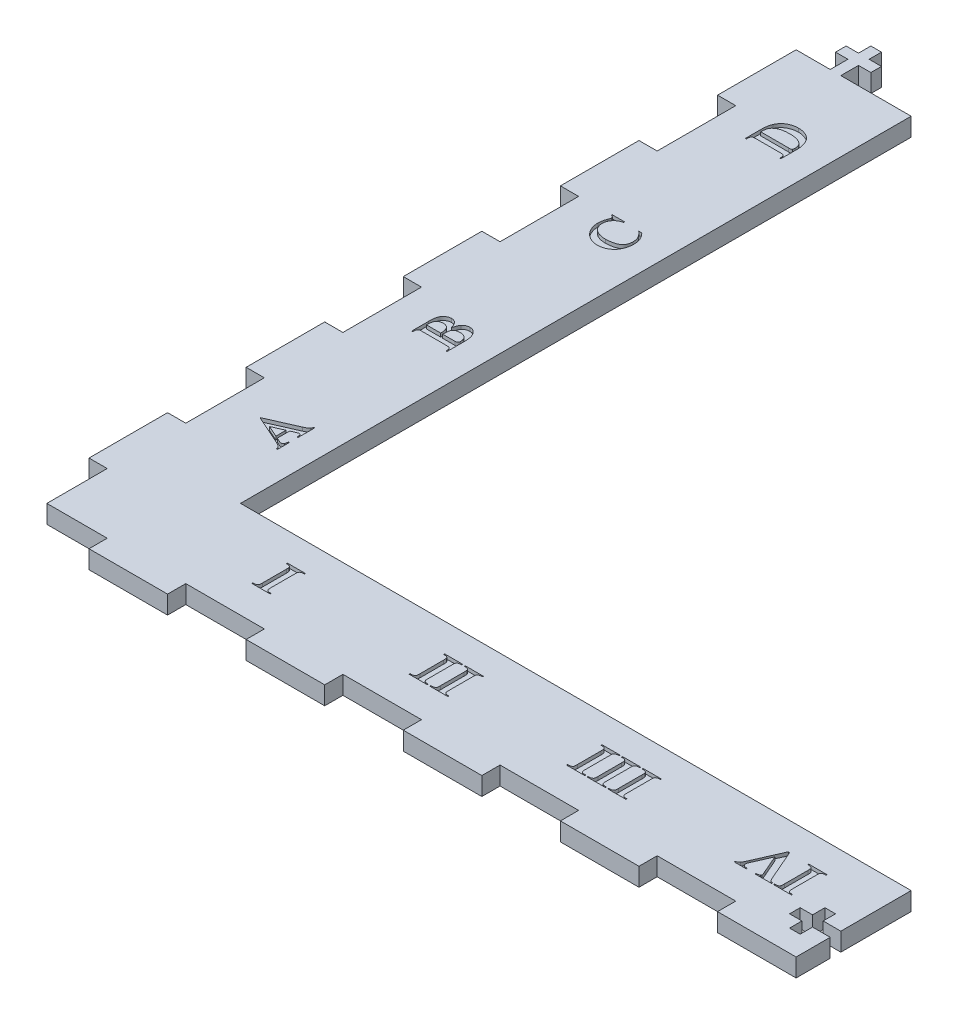
from build123d import *

# Parameters (mm, degrees)
SKETCH1_W           = 222.25
SKETCH1_H           = 222.25
BOSS_EXTRUDE1_DEPTH = 5.15
SKETCH2_W           = 17.075
SKETCH2_H           = 5.15
SKETCH2_W_2         = 22.225
SKETCH2_W_3         = 5.15
SKETCH2_H_2         = 22.225
CUT_EXTRUDE1_DEPTH  = 315.351153171
SKETCH3_W           = 189.70625
SKETCH3_H           = 189.70625
CUT_EXTRUDE2_DEPTH  = 315.351153171
BOSS_EXTRUDE2_DEPTH = 5.15
CUT_EXTRUDE3_DEPTH  = 323.584326185
CUT_EXTRUDE4_DEPTH  = 1


with BuildPart() as part:
    # Sketch1 → Boss-Extrude1 (new body)
    with BuildSketch(Plane(origin=(0, 0, 0), x_dir=(1, 0, 0), z_dir=(0, 1, 0))):
        with Locations((111.125, 111.125)):
            Rectangle(SKETCH1_W, SKETCH1_H)
    extrude(amount=BOSS_EXTRUDE1_DEPTH)

    # Sketch2 → Cut-Extrude1 (cut, through all)
    with BuildSketch(Plane(origin=(0, 5.15, 0), x_dir=(1, 0, 0), z_dir=(0, 1, 0))):
        with Locations((13.6875, 2.575)):
            Rectangle(SKETCH2_W, SKETCH2_H)
        Polygon((0, 22.225), (0, 0), (5.15, 0), (5.15, 5.15), (5.15, 22.225), align=None)
        with Locations((55.5625, 2.575)):
            Rectangle(SKETCH2_W_2, SKETCH2_H)
        with Locations((100.0125, 2.575)):
            Rectangle(SKETCH2_W_2, SKETCH2_H)
        with Locations((144.4625, 2.575)):
            Rectangle(SKETCH2_W_2, SKETCH2_H)
        with Locations((188.9125, 2.575)):
            Rectangle(SKETCH2_W_2, SKETCH2_H)
        with Locations((2.575, 55.5625)):
            Rectangle(SKETCH2_W_3, SKETCH2_H_2)
        with Locations((2.575, 144.4625)):
            Rectangle(SKETCH2_W_3, SKETCH2_H_2)
        with Locations((2.575, 100.0125)):
            Rectangle(SKETCH2_W_3, SKETCH2_H_2)
        with Locations((2.575, 188.9125)):
            Rectangle(SKETCH2_W_3, SKETCH2_H_2)
    extrude(amount=-CUT_EXTRUDE1_DEPTH, mode=Mode.SUBTRACT)

    # Sketch3 → Cut-Extrude2 (cut, through all)
    with BuildSketch(Plane(origin=(0, 5.15, 0), x_dir=(1, 0, 0), z_dir=(0, 1, 0))):
        with Locations((127.396875, 127.396875)):
            Rectangle(SKETCH3_W, SKETCH3_H)
    extrude(amount=-CUT_EXTRUDE2_DEPTH, mode=Mode.SUBTRACT)

    # Sketch4 → Boss-Extrude2 (add)
    with BuildSketch(Plane(origin=(0, 5.15, 0), x_dir=(1, 0, 0), z_dir=(0, 1, 0))):
        Polygon((9.65, 222.25), (9.65, 227.25), (6.15, 227.25), (6.15, 230.25), (9.65, 230.25), (9.65, 233.75), (12.65, 233.75), (12.65, 230.25), (16.15, 230.25), (16.15, 227.25), (12.65, 227.25), (12.65, 222.25), align=None)
    extrude(amount=-BOSS_EXTRUDE2_DEPTH)

    # Sketch5 → Cut-Extrude3 (cut, through all)
    with BuildSketch(Plane(origin=(0, 5.15, 0), x_dir=(1, 0, 0), z_dir=(0, 1, 0))):
        Polygon((222.25, 9.65), (217.25, 9.65), (217.25, 6.15), (214.25, 6.15), (214.25, 9.65), (210.75, 9.65), (210.75, 12.65), (214.25, 12.65), (214.25, 16.15), (217.25, 16.15), (217.25, 12.65), (222.25, 12.65), align=None)
    extrude(amount=-CUT_EXTRUDE3_DEPTH, mode=Mode.SUBTRACT)

    # Sketch6 → Cut-Extrude4 (cut)
    # profile 1 of 12: a face of its own
    with BuildSketch(Plane(origin=(0, 5.15, 0), x_dir=(1, 0, 0), z_dir=(0, 1, 0))):
        with BuildLine():
            Line((21.765972222, 57.207552083), (21.765972222, 53.713628472))
            Line((21.765972222, 53.713628472), (22.764236111, 53.270920139))
            add(Edge.make_bspline(
                [(22.764236111, 53.270920139), (22.836755056, 53.239084656), (22.972593893, 53.179452032), (23.172814371, 53.116743409), (23.351980656, 53.073827045), (23.466441293, 53.067627678), (23.519444444, 53.064756944)],
                knots=[0, 0, 0, 0, 1.20511019, 2.257351726, 3.193033938, 4, 4, 4, 4], degree=3))
            add(Edge.make_bspline(
                [(23.519444444, 53.064756944), (23.581604326, 53.068497188), (23.70013899, 53.075629577), (23.864645043, 53.14256425), (24.002741256, 53.252414712), (24.066101927, 53.351864186), (24.098871528, 53.403298611)],
                knots=[0, 0, 0, 0, 1.052508737, 2.007062559, 2.969269661, 4, 4, 4, 4], degree=3))
            add(Edge.make_bspline(
                [(24.098871528, 53.403298611), (24.107881703, 53.422692947), (24.128174964, 53.46637404), (24.153864012, 53.543329141), (24.176857773, 53.638524148), (24.198251142, 53.751552211), (24.217808784, 53.882580057), (24.234031145, 54.031849356), (24.252252193, 54.198811669), (24.261253683, 54.316171495), (24.265972222, 54.377690972)],
                knots=[0, 0, 0, 0, 0.516447785, 1.163174827, 1.955925178, 2.881493115, 3.941972439, 5.15611017, 6.509246131, 8, 8, 8, 8], degree=3))
            Line((24.265972222, 54.377690972), (24.54375, 54.377690972))
            Line((24.54375, 54.377690972), (24.54375, 50.972743056))
            Line((24.54375, 50.972743056), (24.265972222, 50.972743056))
            add(Edge.make_bspline(
                [(24.265972222, 50.972743056), (24.250147403, 51.058927082), (24.219390032, 51.226435725), (24.124132192, 51.459779652), (24.001559136, 51.672360093), (23.862386161, 51.826449701), (23.730250839, 51.94468162), (23.604884367, 52.037155641), (23.457645405, 52.13705546), (23.285650779, 52.240737551), (23.090526778, 52.348502637), (22.871892222, 52.461900821), (22.630211745, 52.580540545), (22.459861037, 52.659295874), (22.371440972, 52.700173611)],
                knots=[0, 0, 0, 0, 1.168289807, 2.27070664, 3.350200811, 4.43259226, 5.028383973, 5.718741518, 6.512528748, 7.406307845, 8.40177536, 9.491569335, 10.698005977, 12, 12, 12, 12], degree=3))
            Line((22.371440972, 52.700173611), (14.404861111, 56.244010417))
            Line((14.404861111, 56.244010417), (14.404861111, 56.385069444))
            Line((14.404861111, 56.385069444), (22.586284722, 59.983159722))
            add(Edge.make_bspline(
                [(22.586284722, 59.983159722), (22.676163179, 60.024740988), (22.847963755, 60.104222608), (23.090952714, 60.223817368), (23.309000048, 60.335704391), (23.499386488, 60.444724424), (23.66560416, 60.544818185), (23.802432545, 60.644074914), (23.916972174, 60.733067813), (23.979334093, 60.796358959), (24.007725694, 60.825173611)],
                knots=[0, 0, 0, 0, 1.431416527, 2.736119324, 3.914678725, 4.972996326, 5.907365913, 6.71690832, 7.415844973, 8, 8, 8, 8], degree=3))
            add(Edge.make_bspline(
                [(24.007725694, 60.825173611), (24.043110763, 60.869445366), (24.116450902, 60.961204313), (24.188169632, 61.129849491), (24.245974943, 61.319413066), (24.259069341, 61.456193198), (24.265972222, 61.528298611)],
                knots=[0, 0, 0, 0, 0.888738331, 1.842025305, 2.862395767, 4, 4, 4, 4], degree=3))
            Line((24.265972222, 61.528298611), (24.54375, 61.528298611))
            Line((24.54375, 61.528298611), (24.54375, 56.816927083))
            Line((24.54375, 56.816927083), (24.265972222, 56.816927083))
            Line((24.265972222, 56.816927083), (24.265972222, 57.014409722))
            add(Edge.make_bspline(
                [(24.265972222, 57.014409722), (24.264131806, 57.103541858), (24.260722525, 57.268654778), (24.230829903, 57.49391005), (24.18616903, 57.680862179), (24.129167537, 57.780617777), (24.103211806, 57.826041667)],
                knots=[0, 0, 0, 0, 1.275087925, 2.36203799, 3.254151068, 4, 4, 4, 4], degree=3))
            add(Edge.make_bspline(
                [(24.103211806, 57.826041667), (24.082516164, 57.850190838), (24.041406467, 57.898160605), (23.961058189, 57.952903777), (23.864646206, 57.979591988), (23.797352174, 57.984229919), (23.7625, 57.986631944)],
                knots=[0, 0, 0, 0, 0.973056627, 1.932873771, 2.929417044, 4, 4, 4, 4], degree=3))
            add(Edge.make_bspline(
                [(23.7625, 57.986631944), (23.717397271, 57.984631782), (23.624629981, 57.980517848), (23.535076025, 57.955885474), (23.4890625, 57.943229167)],
                knots=[0, 0, 0, 0, 0.972384328, 2, 2, 2, 2], degree=3))
            add(Edge.make_bspline(
                [(23.4890625, 57.943229167), (23.469474911, 57.936875885), (23.411543152, 57.918085581), (23.30029124, 57.872929595), (23.134266556, 57.809149017), (23.007804307, 57.754954665), (22.935677083, 57.724045139)],
                knots=[0, 0, 0, 0, 0.414962549, 1.227282742, 2.418592111, 4, 4, 4, 4], degree=3))
            Line((22.935677083, 57.724045139), (21.765972222, 57.207552083))
        make_face()
        Polygon((21.071527778, 56.903732639), (17.814149306, 55.471440972), (21.071527778, 54.021788194), align=None, mode=Mode.SUBTRACT)
    # profile 2 of 12: a face of its own
    with BuildSketch(Plane(origin=(0, 5.15, 0), x_dir=(1, 0, 0), z_dir=(0, 1, 0))):
        with BuildLine():
            add(Edge.make_bspline(
                [(19.320225694, 105.395833333), (19.347844365, 105.506662625), (19.400931899, 105.719694377), (19.487324774, 106.025730057), (19.580777152, 106.305705721), (19.677749242, 106.560551415), (19.776919256, 106.79133709), (19.883815714, 106.994000411), (19.990114533, 107.175267934), (20.072824935, 107.27959959), (20.112326389, 107.329427083)],
                knots=[0, 0, 0, 0, 1.3018785, 2.50242019, 3.623606461, 4.664906884, 5.610106471, 6.484152907, 7.27605039, 8, 8, 8, 8], degree=3))
            add(Edge.make_bspline(
                [(20.112326389, 107.329427083), (20.168141152, 107.39292857), (20.278136194, 107.518071961), (20.463570902, 107.680735385), (20.660739641, 107.819035179), (20.869961293, 107.933213073), (21.092874308, 108.019346069), (21.326805623, 108.083357342), (21.57310898, 108.120211149), (21.741257861, 108.125400298), (21.826736111, 108.128038194)],
                knots=[0, 0, 0, 0, 1.035697958, 2.041066434, 3.015403767, 3.983707993, 4.95541804, 5.938635633, 6.95210828, 8, 8, 8, 8], degree=3))
            add(Edge.make_bspline(
                [(21.826736111, 108.128038194), (21.917363978, 108.126029425), (22.096093258, 108.122067884), (22.357024346, 108.07595077), (22.607691172, 108.007875974), (22.8443019, 107.906374248), (23.070007524, 107.780237028), (23.282385138, 107.623913852), (23.482365075, 107.438853697), (23.603222402, 107.298826181), (23.66484375, 107.227430556)],
                knots=[0, 0, 0, 0, 1.024211294, 2.019870407, 2.988937447, 3.957209277, 4.924650625, 5.908466303, 6.933592771, 8, 8, 8, 8], degree=3))
            add(Edge.make_bspline(
                [(23.66484375, 107.227430556), (23.735937346, 107.131318469), (23.880276943, 106.936184441), (24.056147752, 106.608563318), (24.209484464, 106.253302665), (24.332497216, 105.864890659), (24.426265566, 105.445668601), (24.495895983, 104.99628176), (24.537289597, 104.515540258), (24.541552279, 104.184255941), (24.54375, 104.013454861)],
                knots=[0, 0, 0, 0, 0.844505621, 1.714579189, 2.622108713, 3.57828338, 4.590979665, 5.657487751, 6.79226513, 8, 8, 8, 8], degree=3))
            Line((24.54375, 104.013454861), (24.54375, 98.967881944))
            Line((24.54375, 98.967881944), (24.265972222, 98.967881944))
            add(Edge.make_bspline(
                [(24.265972222, 98.967881944), (24.265500716, 99.074304543), (24.264636386, 99.269390486), (24.240206983, 99.533156324), (24.208289167, 99.743538669), (24.152562334, 99.902804455), (24.083836522, 100.023163158), (24.009295739, 100.120302057), (23.926476331, 100.200796291), (23.845254193, 100.251380305), (23.768618475, 100.284723195), (23.692728319, 100.301750156), (23.60021356, 100.319705597), (23.490110672, 100.334543236), (23.361918892, 100.345078069), (23.215664061, 100.350783071), (23.052166744, 100.355216978), (22.937127443, 100.356237945), (22.877083333, 100.356770833)],
                knots=[0, 0, 0, 0, 2.131061231, 3.906501934, 5.305304077, 6.382647868, 7.265354905, 8.071304562, 8.829992979, 9.565911323, 9.975094088, 10.498887173, 11.118579713, 11.864703884, 12.722914985, 13.694985785, 14.796910925, 16, 16, 16, 16], degree=3))
            Line((22.877083333, 100.356770833), (16.210416667, 100.356770833))
            add(Edge.make_bspline(
                [(16.210416667, 100.356770833), (16.150372753, 100.356237119), (16.035333826, 100.355214567), (15.87183398, 100.35079135), (15.725587198, 100.345052325), (15.597370537, 100.334622663), (15.486637769, 100.31937181), (15.393216119, 100.302156302), (15.316229446, 100.284164781), (15.238226302, 100.25226707), (15.156718719, 100.199905551), (15.071040276, 100.120932081), (14.997098677, 100.021211517), (14.93134306, 99.898633878), (14.877028024, 99.739037028), (14.84822951, 99.52928137), (14.822548605, 99.267270311), (14.821888238, 99.073597835), (14.821527778, 98.967881944)],
                knots=[0, 0, 0, 0, 1.201644639, 2.3022468, 3.273150526, 4.130331253, 4.875559622, 5.508734867, 6.031899083, 6.453960745, 7.188995541, 7.957346903, 8.773832027, 9.661165858, 10.732433931, 12.127079426, 13.885970896, 16, 16, 16, 16], degree=3))
            Line((14.821527778, 98.967881944), (14.54375, 98.967881944))
            Line((14.54375, 98.967881944), (14.54375, 103.748697917))
            add(Edge.make_bspline(
                [(14.54375, 103.748697917), (14.544290375, 103.886159151), (14.545331677, 104.151046509), (14.561379133, 104.532372637), (14.583816983, 104.88283429), (14.618539409, 105.201326848), (14.661472819, 105.48887456), (14.712547653, 105.745736556), (14.773808263, 105.972066821), (14.872535898, 106.228233797), (15.020275593, 106.511605175), (15.234646103, 106.815687883), (15.489355609, 107.081015254), (15.778813647, 107.305150396), (16.092152614, 107.484054142), (16.418215966, 107.617662391), (16.756523252, 107.695716718), (16.985496154, 107.706147457), (17.100173611, 107.711371528)],
                knots=[0, 0, 0, 0, 1.236384687, 2.382509335, 3.43256694, 4.394734473, 5.26345192, 6.04698973, 6.749526979, 7.369463362, 8.51322128, 9.614565587, 10.705267144, 11.808992407, 12.896136209, 13.941323756, 14.968944562, 16, 16, 16, 16], degree=3))
            add(Edge.make_bspline(
                [(17.100173611, 107.711371528), (17.161025396, 107.709626731), (17.281027275, 107.70618593), (17.458132625, 107.681114339), (17.63015347, 107.643268697), (17.79593779, 107.585265446), (17.957840148, 107.514001226), (18.113954171, 107.423918044), (18.2659895, 107.31993226), (18.413770777, 107.199098012), (18.554662988, 107.057917041), (18.688715854, 106.893522608), (18.811301008, 106.702017036), (18.930846491, 106.489168148), (19.038387182, 106.249073104), (19.142858172, 105.987544014), (19.238281204, 105.700527053), (19.29232533, 105.499575093), (19.320225694, 105.395833333)],
                knots=[0, 0, 0, 0, 0.837700207, 1.651974515, 2.45908848, 3.259226073, 4.066340038, 4.8916893, 5.737171266, 6.600652875, 7.51633735, 8.479346436, 9.515420937, 10.643561238, 11.838132437, 13.134828771, 14.520850928, 16, 16, 16, 16], degree=3))
        make_face()
        with BuildLine():
            add(Edge.make_bspline(
                [(19.127083333, 102.578993056), (19.126093085, 102.67014655), (19.124182598, 102.846009159), (19.114021733, 103.100861124), (19.09428915, 103.336788419), (19.068590848, 103.554000514), (19.036754246, 103.752727264), (18.995857744, 103.933358077), (18.946446958, 104.095841323), (18.872093207, 104.284793856), (18.761151299, 104.494954852), (18.602698289, 104.718368018), (18.417943853, 104.909602142), (18.209602047, 105.070205655), (17.97343331, 105.199608856), (17.70541883, 105.286011776), (17.408513886, 105.342331237), (17.200285266, 105.347539356), (17.091493056, 105.350260417)],
                knots=[0, 0, 0, 0, 1.110806269, 2.143080642, 3.107164857, 3.994970076, 4.807942402, 5.558496631, 6.24999605, 6.875288794, 8.0305674, 9.13622039, 10.202229732, 11.258316361, 12.331155439, 13.465666654, 14.675898984, 16, 16, 16, 16], degree=3))
            add(Edge.make_bspline(
                [(17.091493056, 105.350260417), (16.983504276, 105.347126265), (16.775569499, 105.341091388), (16.478472265, 105.289744353), (16.211843086, 105.200585662), (15.975964518, 105.075367918), (15.76957002, 104.916598923), (15.589484988, 104.727712486), (15.437101134, 104.507693519), (15.33112681, 104.301527173), (15.262670656, 104.115182294), (15.217825061, 103.953974558), (15.178510887, 103.773693502), (15.149127375, 103.572743167), (15.125819472, 103.352640284), (15.10793813, 103.112391373), (15.10016046, 102.852485001), (15.09959726, 102.672312045), (15.099305556, 102.578993056)],
                knots=[0, 0, 0, 0, 1.319267163, 2.540278011, 3.669834851, 4.741725605, 5.788602006, 6.839205284, 7.918436596, 9.049307559, 9.661922037, 10.342021117, 11.092916388, 11.91568999, 12.822742555, 13.797866023, 14.859424176, 16, 16, 16, 16], degree=3))
            Line((15.099305556, 102.578993056), (19.127083333, 102.578993056))
        make_face(mode=Mode.SUBTRACT)
        with BuildLine():
            Line((19.682638889, 102.578993056), (22.835850694, 102.578993056))
            Line((22.835850694, 102.578993056), (23.198263889, 102.578993056))
            add(Edge.make_bspline(
                [(23.198263889, 102.578993056), (23.25997188, 102.581293904), (23.375959147, 102.585618612), (23.538818522, 102.622791564), (23.678780269, 102.684819767), (23.792682588, 102.777003119), (23.882179439, 102.893569941), (23.944508591, 103.034872061), (23.981516992, 103.199958749), (23.985876479, 103.317354347), (23.988194444, 103.379774306)],
                knots=[0, 0, 0, 0, 1.149639995, 2.160880631, 3.096579671, 3.979429784, 4.86454494, 5.812516284, 6.836901498, 8, 8, 8, 8], degree=3))
            add(Edge.make_bspline(
                [(23.988194444, 103.379774306), (23.985821757, 103.476243348), (23.98114975, 103.666198496), (23.927689423, 103.944009604), (23.848892889, 104.211774921), (23.732699343, 104.463699611), (23.592277658, 104.699731239), (23.415502735, 104.905547934), (23.211311324, 105.083866024), (22.97896581, 105.230987307), (22.72433627, 105.344034867), (22.455872555, 105.431526046), (22.171233331, 105.478153536), (21.977348264, 105.485444282), (21.878819444, 105.489149306)],
                knots=[0, 0, 0, 0, 1.035205226, 2.038400689, 3.029325947, 4.027691942, 5.011488699, 5.970910565, 6.929513463, 7.914936255, 8.91330225, 9.916256792, 10.941080084, 12, 12, 12, 12], degree=3))
            add(Edge.make_bspline(
                [(21.878819444, 105.489149306), (21.765830615, 105.486208011), (21.545498649, 105.480472389), (21.223303635, 105.436356516), (20.919036693, 105.363003781), (20.634219673, 105.260976244), (20.374735217, 105.122715607), (20.158991176, 104.92815934), (19.989567553, 104.68577252), (19.888580484, 104.449120556), (19.826745908, 104.237131996), (19.789067712, 104.055355615), (19.753704729, 103.855776817), (19.726512827, 103.636996591), (19.703946655, 103.399686209), (19.692913863, 103.143303394), (19.683054438, 102.867698011), (19.682780509, 102.677384072), (19.682638889, 102.578993056)],
                knots=[0, 0, 0, 0, 1.26403083, 2.464902064, 3.631088854, 4.760425681, 5.843835012, 6.898560767, 7.978820646, 9.127828599, 9.760504583, 10.447975377, 11.203858292, 12.028158985, 12.914177547, 13.870576288, 14.899102375, 16, 16, 16, 16], degree=3))
        make_face(mode=Mode.SUBTRACT)
    # profile 3 of 12: a face of its own
    with BuildSketch(Plane(origin=(0, 5.15, 0), x_dir=(1, 0, 0), z_dir=(0, 1, 0))):
        with BuildLine():
            Line((14.404861111, 155.832378472), (17.877083333, 155.832378472))
            Line((17.877083333, 155.832378472), (17.877083333, 155.554600694))
            add(Edge.make_bspline(
                [(17.877083333, 155.554600694), (17.76816354, 155.525629122), (17.553976348, 155.468657479), (17.245739413, 155.360709584), (16.958085983, 155.231955635), (16.689802144, 155.085816584), (16.439835114, 154.923939193), (16.209963056, 154.742592471), (16.001364854, 154.542139279), (15.812745835, 154.325516004), (15.646687922, 154.095679066), (15.500751803, 153.858565946), (15.375134127, 153.614847986), (15.276615658, 153.361008619), (15.193882202, 153.101535944), (15.142344496, 152.832574371), (15.104480506, 152.557988348), (15.101044279, 152.371867675), (15.099305556, 152.277690972)],
                knots=[0, 0, 0, 0, 1.161787254, 2.284616432, 3.36299313, 4.407647858, 5.431650522, 6.429905981, 7.421620198, 8.410216383, 9.387380055, 10.341646711, 11.278944789, 12.209661703, 13.146247323, 14.082387382, 15.029691697, 16, 16, 16, 16], degree=3))
            add(Edge.make_bspline(
                [(15.099305556, 152.277690972), (15.10110899, 152.198783905), (15.104674454, 152.042781347), (15.129111666, 151.810613622), (15.169779574, 151.583402144), (15.228862095, 151.361639834), (15.303781601, 151.145218596), (15.391600816, 150.932541534), (15.499052314, 150.72538084), (15.622539825, 150.525172247), (15.757347631, 150.332564163), (15.906966819, 150.154779381), (16.061841814, 149.986420776), (16.230327105, 149.834148076), (16.408496601, 149.695622845), (16.59524685, 149.568376867), (16.793861137, 149.458162038), (16.931249227, 149.393530237), (17.000347222, 149.361024306)],
                knots=[0, 0, 0, 0, 1.028142808, 2.032681163, 3.038501241, 4.033083746, 5.019773326, 6.021122381, 7.028707677, 8.056893694, 9.084733985, 10.088874233, 11.082562971, 12.063472352, 13.04397403, 14.021753348, 15.005060214, 16, 16, 16, 16], degree=3))
            add(Edge.make_bspline(
                [(17.000347222, 149.361024306), (17.091763335, 149.32292402), (17.275486829, 149.246351986), (17.560517749, 149.153052956), (17.851450833, 149.068275087), (18.151490903, 149.005348517), (18.458175328, 148.951696359), (18.772754414, 148.916567404), (19.094811867, 148.890301897), (19.312211947, 148.888729635), (19.422222222, 148.887934028)],
                knots=[0, 0, 0, 0, 0.956197261, 1.921717052, 2.894866345, 3.881565461, 4.880873955, 5.900899592, 6.937798853, 8, 8, 8, 8], degree=3))
            add(Edge.make_bspline(
                [(19.422222222, 148.887934028), (19.635765205, 148.892160999), (20.054399557, 148.900447647), (20.667659229, 148.963626134), (21.251448119, 149.070554804), (21.716550897, 149.191796759), (22.067928205, 149.313631613), (22.312887586, 149.417568068), (22.541632782, 149.533362821), (22.755229829, 149.65753152), (22.949781125, 149.798974149), (23.12977398, 149.949709127), (23.293201148, 150.113069723), (23.440363781, 150.288453816), (23.570313106, 150.476300504), (23.681843361, 150.678886709), (23.777199948, 150.893672385), (23.856096355, 151.122126278), (23.913204356, 151.364574305), (23.957288373, 151.61954535), (23.983328865, 151.88797196), (23.986553587, 152.071472128), (23.988194444, 152.16484375)],
                knots=[0, 0, 0, 0, 2.006715093, 3.934008325, 5.786214914, 7.580418681, 8.444766902, 9.279435686, 10.07906408, 10.853259901, 11.598527692, 12.336691597, 13.05778344, 13.767211433, 14.485702655, 15.200840944, 15.93737507, 16.692010689, 17.468650373, 18.275614829, 19.122569525, 20, 20, 20, 20], degree=3))
            add(Edge.make_bspline(
                [(23.988194444, 152.16484375), (23.983079353, 152.319214523), (23.972977959, 152.624069323), (23.896222236, 153.070608701), (23.765974933, 153.49616969), (23.617790802, 153.835506626), (23.468982526, 154.098673838), (23.341330181, 154.300940998), (23.193037097, 154.504972952), (23.025485216, 154.710583793), (22.840668299, 154.918903387), (22.638492425, 155.130102884), (22.416418144, 155.342295941), (22.26041113, 155.482669391), (22.18046875, 155.554600694)],
                knots=[0, 0, 0, 0, 1.396783461, 2.758398715, 4.086013446, 5.416901444, 6.099893596, 6.820987382, 7.580585504, 8.381230586, 9.2207398, 10.100564554, 11.026675872, 12, 12, 12, 12], degree=3))
            Line((22.18046875, 155.554600694), (23.037673611, 155.554600694))
            add(Edge.make_bspline(
                [(23.037673611, 155.554600694), (23.174912053, 155.415256154), (23.441206209, 155.144875377), (23.786204707, 154.709200761), (24.073442526, 154.266141615), (24.300436622, 153.807107404), (24.475759987, 153.32574351), (24.594827265, 152.809790358), (24.670620335, 152.256797457), (24.67855768, 151.875029431), (24.682638889, 151.678732639)],
                knots=[0, 0, 0, 0, 1.080416825, 2.096414687, 3.065803322, 3.993871318, 4.921008592, 5.890850669, 6.915521415, 8, 8, 8, 8], degree=3))
            add(Edge.make_bspline(
                [(24.682638889, 151.678732639), (24.680223865, 151.547035308), (24.675467955, 151.287683536), (24.647659529, 150.903539339), (24.597611828, 150.531194742), (24.52820504, 150.169591317), (24.4391233, 149.819566297), (24.331098237, 149.480848835), (24.201918574, 149.153566078), (24.05517401, 148.838148474), (23.89098409, 148.535424576), (23.70617628, 148.25193177), (23.505275106, 147.984508668), (23.286695539, 147.73587425), (23.050961333, 147.504506498), (22.798321612, 147.290511483), (22.526700581, 147.096168858), (22.241061413, 146.918551029), (21.944972427, 146.761132342), (21.642284066, 146.6233702), (21.333995201, 146.508411068), (21.02054349, 146.415184547), (20.703098404, 146.341468276), (20.381613954, 146.285932222), (20.05431151, 146.255917263), (19.834604049, 146.251348031), (19.723871528, 146.249045139)],
                knots=[0, 0, 0, 0, 1.149963355, 2.264624732, 3.360663201, 4.428438568, 5.477785413, 6.512469279, 7.530537114, 8.547801339, 9.548399477, 10.534722272, 11.499825188, 12.466538847, 13.422337747, 14.381469871, 15.35433334, 16.335831227, 17.31631246, 18.280215899, 19.237537022, 20.186739433, 21.133564285, 22.081589182, 23.033121288, 24, 24, 24, 24], degree=3))
            add(Edge.make_bspline(
                [(19.723871528, 146.249045139), (19.607292561, 146.250681201), (19.375702037, 146.253931327), (19.030852261, 146.293926219), (18.689856418, 146.351226042), (18.353259715, 146.433819959), (18.021523192, 146.541403937), (17.694109753, 146.67090085), (17.371491101, 146.826789621), (17.055082732, 147.002861045), (16.749598232, 147.199662582), (16.461007786, 147.41508302), (16.188319112, 147.645371291), (15.933973046, 147.893541816), (15.69726829, 148.157963135), (15.479623492, 148.440239683), (15.277435585, 148.736532444), (15.096177997, 149.049096392), (14.933519037, 149.371440538), (14.792687047, 149.701416353), (14.672431504, 150.036764722), (14.57540856, 150.37692567), (14.498493847, 150.721760682), (14.444842699, 151.071200027), (14.410959041, 151.426325043), (14.406903538, 151.664912412), (14.404861111, 151.785069444)],
                knots=[0, 0, 0, 0, 0.984426118, 1.955616584, 2.929207734, 3.904542865, 4.880567062, 5.873587323, 6.876786148, 7.905499085, 8.931102995, 9.944396575, 10.946030462, 11.944377479, 12.944219867, 13.941743474, 14.953709207, 15.97255351, 16.992020836, 18.002342792, 19.001736804, 19.999878032, 20.98890328, 21.984646748, 22.985030656, 24, 24, 24, 24], degree=3))
            add(Edge.make_bspline(
                [(14.404861111, 151.785069444), (14.410650361, 151.965493872), (14.422471609, 152.333908092), (14.509802875, 152.892214495), (14.645329838, 153.46617996), (14.776197495, 153.845534637), (14.843229167, 154.03984375)],
                knots=[0, 0, 0, 0, 0.937759516, 1.914840166, 2.931961085, 4, 4, 4, 4], degree=3))
            add(Edge.make_bspline(
                [(14.843229167, 154.03984375), (14.863745491, 154.094000156), (14.90298385, 154.197576625), (14.954597996, 154.346091456), (14.997523153, 154.479567344), (15.036166397, 154.595152023), (15.06066773, 154.697465145), (15.084333664, 154.781928204), (15.095293484, 154.852652849), (15.098086601, 154.894135844), (15.099305556, 154.912239583)],
                knots=[0, 0, 0, 0, 1.524309343, 2.915307572, 4.137611713, 5.215545272, 6.120719531, 6.905778784, 7.522467099, 8, 8, 8, 8], degree=3))
            add(Edge.make_bspline(
                [(15.099305556, 154.912239583), (15.097084496, 154.950766821), (15.092697129, 155.026871559), (15.061743449, 155.137237307), (15.008369561, 155.239046911), (14.933131107, 155.331148475), (14.836200536, 155.412908067), (14.714394016, 155.478137658), (14.567840557, 155.525124959), (14.461574635, 155.54434374), (14.404861111, 155.554600694)],
                knots=[0, 0, 0, 0, 0.886492629, 1.751132284, 2.615130278, 3.514973048, 4.472301437, 5.515567395, 6.674072326, 8, 8, 8, 8], degree=3))
            Line((14.404861111, 155.554600694), (14.404861111, 155.832378472))
        make_face()
    # profile 4 of 12: a face of its own
    with BuildSketch(Plane(origin=(0, 5.15, 0), x_dir=(1, 0, 0), z_dir=(0, 1, 0))):
        with BuildLine():
            Line((24.54375, 193.397829861), (24.265972222, 193.397829861))
            Line((24.265972222, 193.397829861), (24.265972222, 193.725520833))
            add(Edge.make_bspline(
                [(24.265972222, 193.725520833), (24.264334565, 193.792873875), (24.261258799, 193.919373023), (24.238103303, 194.097174881), (24.198253517, 194.251313049), (24.138276623, 194.381551696), (24.066080414, 194.4918178), (23.981312373, 194.584674237), (23.886324789, 194.665047865), (23.812553607, 194.702708918), (23.775520833, 194.721614583)],
                knots=[0, 0, 0, 0, 1.371556038, 2.575988656, 3.644707394, 4.600734752, 5.483440597, 6.317979242, 7.155633787, 8, 8, 8, 8], degree=3))
            add(Edge.make_bspline(
                [(23.775520833, 194.721614583), (23.759703044, 194.727030269), (23.722923862, 194.739622703), (23.656492001, 194.751546827), (23.572343531, 194.761304284), (23.46980071, 194.773459334), (23.348036907, 194.778609861), (23.20767511, 194.782321479), (23.04856048, 194.788036373), (22.936406123, 194.787174584), (22.877083333, 194.78671875)],
                knots=[0, 0, 0, 0, 0.443546268, 1.031324162, 1.786729535, 2.694794477, 3.772216006, 5.021594906, 6.424606037, 8, 8, 8, 8], degree=3))
            Line((22.877083333, 194.78671875), (16.210416667, 194.78671875))
            add(Edge.make_bspline(
                [(16.210416667, 194.78671875), (16.151825204, 194.785890273), (16.039704931, 194.784304904), (15.880484675, 194.783693243), (15.738662102, 194.776720879), (15.614284861, 194.767750016), (15.506706044, 194.759000304), (15.416820769, 194.741647126), (15.343169433, 194.729546881), (15.26938882, 194.702300618), (15.190336055, 194.657686546), (15.105790058, 194.58483901), (15.027546342, 194.492172585), (14.955305124, 194.380670256), (14.893940049, 194.24761965), (14.852039334, 194.092191592), (14.825610539, 193.915947602), (14.822941428, 193.791455833), (14.821527778, 193.725520833)],
                knots=[0, 0, 0, 0, 1.353804055, 2.590631371, 3.678090953, 4.633038001, 5.472823534, 6.167945078, 6.748082955, 7.192141313, 7.977799851, 8.831603391, 9.756085287, 10.771283584, 11.893005217, 13.125761034, 14.477707027, 16, 16, 16, 16], degree=3))
            Line((14.821527778, 193.725520833), (14.821527778, 193.397829861))
            Line((14.821527778, 193.397829861), (14.54375, 193.397829861))
            Line((14.54375, 193.397829861), (14.54375, 197.842274306))
            add(Edge.make_bspline(
                [(14.54375, 197.842274306), (14.54578813, 197.986965608), (14.549764777, 198.269276377), (14.569846362, 198.681456394), (14.61065303, 199.071384166), (14.660170242, 199.440617859), (14.731117426, 199.78779547), (14.811780103, 200.114702222), (14.911459895, 200.419014615), (14.991072694, 200.611100632), (15.029861111, 200.7046875)],
                knots=[0, 0, 0, 0, 1.187906791, 2.317754251, 3.386079108, 4.405608621, 5.374560436, 6.293451186, 7.168546674, 8, 8, 8, 8], degree=3))
            add(Edge.make_bspline(
                [(15.029861111, 200.7046875), (15.080846961, 200.812699256), (15.18185186, 201.026674634), (15.363421568, 201.327363859), (15.561586641, 201.608589132), (15.776814272, 201.871415522), (16.014307929, 202.111582839), (16.269062394, 202.33430204), (16.542888878, 202.536977268), (16.836773314, 202.71595926), (17.143518301, 202.876159999), (17.461666765, 203.014436353), (17.788099067, 203.136419422), (18.127189259, 203.22933172), (18.474388734, 203.307423202), (18.832271694, 203.3574821), (19.199466463, 203.392013041), (19.448180432, 203.395874417), (19.574131944, 203.397829861)],
                knots=[0, 0, 0, 0, 1.023059056, 2.026718722, 3.005407045, 3.969834614, 4.934282109, 5.896555333, 6.867417257, 7.849868272, 8.842554442, 9.830817097, 10.821274577, 11.826120625, 12.841487115, 13.869025607, 14.920850928, 16, 16, 16, 16], degree=3))
            add(Edge.make_bspline(
                [(19.574131944, 203.397829861), (19.7465005, 203.393661103), (20.08589669, 203.385452758), (20.584012386, 203.320630864), (21.062032046, 203.218249585), (21.513902111, 203.06897982), (21.937461828, 202.891026117), (22.325163389, 202.684362609), (22.675735658, 202.45466846), (22.985416179, 202.195745806), (23.261914486, 201.915997602), (23.511576501, 201.618253095), (23.728351084, 201.297275931), (23.920361421, 200.954315185), (24.085108684, 200.579981524), (24.23377846, 200.171910963), (24.355769325, 199.722564873), (24.421009063, 199.408763874), (24.454774306, 199.246354167)],
                knots=[0, 0, 0, 0, 1.173334652, 2.31031297, 3.414632536, 4.497207468, 5.545626729, 6.539445375, 7.484807406, 8.394223601, 9.282382038, 10.16026446, 11.035988561, 11.915803431, 12.833029565, 13.817761749, 14.870568686, 16, 16, 16, 16], degree=3))
            add(Edge.make_bspline(
                [(24.454774306, 199.246354167), (24.468889989, 199.16186229), (24.500602943, 198.972038883), (24.525817819, 198.652160804), (24.539507112, 198.268480051), (24.542266371, 197.991307517), (24.54375, 197.842274306)],
                knots=[0, 0, 0, 0, 0.729469202, 1.638859668, 2.730435796, 4, 4, 4, 4], degree=3))
            Line((24.54375, 197.842274306), (24.54375, 193.397829861))
        make_face()
        with BuildLine():
            Line((15.099305556, 197.147829861), (22.903125, 197.147829861))
            add(Edge.make_bspline(
                [(22.903125, 197.147829861), (22.996459013, 197.148607774), (23.163671747, 197.150001444), (23.383782327, 197.160324433), (23.544690025, 197.174361212), (23.678746689, 197.204859453), (23.79482273, 197.280545521), (23.84978595, 197.363979967), (23.877517361, 197.406076389)],
                knots=[0, 0, 0, 0, 1.582129184, 2.834466657, 3.735032046, 4.318012859, 5.151362027, 6, 6, 6, 6], degree=3))
            add(Edge.make_bspline(
                [(23.877517361, 197.406076389), (23.894677245, 197.442517702), (23.931619517, 197.520969566), (23.963011378, 197.656495809), (23.985992664, 197.812540647), (23.987428292, 197.923902686), (23.988194444, 197.983333333)],
                knots=[0, 0, 0, 0, 0.812832084, 1.749887298, 2.799180973, 4, 4, 4, 4], degree=3))
            add(Edge.make_bspline(
                [(23.988194444, 197.983333333), (23.985762321, 198.083275311), (23.981019392, 198.278174022), (23.942117085, 198.562213937), (23.87406048, 198.827208093), (23.784307519, 199.075551862), (23.662563768, 199.302265262), (23.518738274, 199.513252205), (23.347001757, 199.705930815), (23.213540007, 199.815867863), (23.146180556, 199.871354167)],
                knots=[0, 0, 0, 0, 1.117658457, 2.179566554, 3.198078308, 4.173511569, 5.125438597, 6.068069882, 7.024935961, 8, 8, 8, 8], degree=3))
            add(Edge.make_bspline(
                [(23.146180556, 199.871354167), (23.046533997, 199.943361454), (22.842121374, 200.091075522), (22.494819254, 200.269182215), (22.11118089, 200.419997533), (21.689250541, 200.547538147), (21.226699189, 200.639681249), (20.725954346, 200.708459451), (20.186921434, 200.753306232), (19.81438722, 200.757021207), (19.621875, 200.758940972)],
                knots=[0, 0, 0, 0, 0.797078974, 1.635109187, 2.524487455, 3.470761747, 4.49202576, 5.582399932, 6.750671646, 8, 8, 8, 8], degree=3))
            add(Edge.make_bspline(
                [(19.621875, 200.758940972), (19.465579143, 200.757527795), (19.160674459, 200.754770943), (18.715283509, 200.726006033), (18.293578068, 200.679270309), (17.896067014, 200.611487535), (17.522171903, 200.528613168), (17.173035512, 200.423213809), (16.846549003, 200.30235977), (16.64364453, 200.200845564), (16.544618056, 200.151302083)],
                knots=[0, 0, 0, 0, 1.184457476, 2.310660313, 3.381113584, 4.398734162, 5.365689401, 6.281539716, 7.161314381, 8, 8, 8, 8], degree=3))
            add(Edge.make_bspline(
                [(16.544618056, 200.151302083), (16.472430037, 200.111040803), (16.331013238, 200.032168694), (16.132316831, 199.899440649), (15.952965643, 199.755690966), (15.788620582, 199.606649676), (15.644707643, 199.446901607), (15.518340049, 199.279213955), (15.40830411, 199.103112839), (15.349835647, 198.978616882), (15.320659722, 198.916493056)],
                knots=[0, 0, 0, 0, 1.119203169, 2.192526294, 3.2314494, 4.229902878, 5.194072597, 6.13852841, 7.071120527, 8, 8, 8, 8], degree=3))
            add(Edge.make_bspline(
                [(15.320659722, 198.916493056), (15.301646965, 198.868338832), (15.261671124, 198.767090729), (15.217660354, 198.59943136), (15.178335961, 198.411243038), (15.149249368, 198.200125586), (15.125611915, 197.967775153), (15.108015855, 197.713758441), (15.100132232, 197.437958311), (15.099587944, 197.246936324), (15.099305556, 197.147829861)],
                knots=[0, 0, 0, 0, 0.692518899, 1.456076319, 2.316420686, 3.265494417, 4.307135134, 5.442799475, 6.673267388, 8, 8, 8, 8], degree=3))
        make_face(mode=Mode.SUBTRACT)
    # profile 5 of 12: a face of its own
    with BuildSketch(Plane(origin=(0, 5.15, 0), x_dir=(1, 0, 0), z_dir=(0, 1, 0))):
        with BuildLine():
            Line((58.895920139, 24.265972222), (58.895920139, 24.54375))
            Line((58.895920139, 24.54375), (53.75703125, 24.54375))
            Line((53.75703125, 24.54375), (53.75703125, 24.265972222))
            Line((53.75703125, 24.265972222), (54.084722222, 24.265972222))
            add(Edge.make_bspline(
                [(54.084722222, 24.265972222), (54.152846957, 24.264699678), (54.282518146, 24.262277469), (54.466799558, 24.233489833), (54.631294604, 24.187898981), (54.728402829, 24.139412221), (54.774826389, 24.116232639)],
                knots=[0, 0, 0, 0, 1.144467932, 2.17842344, 3.129177061, 4, 4, 4, 4], degree=3))
            add(Edge.make_bspline(
                [(54.774826389, 24.116232639), (54.805324913, 24.097834379), (54.867016407, 24.060618933), (54.946247447, 23.981786518), (55.013389669, 23.885690776), (55.047859296, 23.812990619), (55.065625, 23.775520833)],
                knots=[0, 0, 0, 0, 0.93343552, 1.888125192, 2.911536119, 4, 4, 4, 4], degree=3))
            add(Edge.make_bspline(
                [(55.065625, 23.775520833), (55.072680664, 23.758325185), (55.08848447, 23.719809078), (55.10145522, 23.649798651), (55.117939951, 23.564142262), (55.127154496, 23.459492203), (55.135809326, 23.338704741), (55.142929982, 23.200509716), (55.143508846, 23.044900705), (55.145088663, 22.934951064), (55.145920139, 22.877083333)],
                knots=[0, 0, 0, 0, 0.491143652, 1.100100526, 1.878201893, 2.802922625, 3.87869145, 5.087223688, 6.466973141, 8, 8, 8, 8], degree=3))
            Line((55.145920139, 22.877083333), (55.145920139, 16.210416667))
            add(Edge.make_bspline(
                [(55.145920139, 16.210416667), (55.145091662, 16.151825204), (55.143506293, 16.039704931), (55.142894632, 15.880484675), (55.135922268, 15.738662102), (55.126951405, 15.614284861), (55.118201693, 15.506706044), (55.100848515, 15.416820769), (55.08874827, 15.343169433), (55.061502007, 15.26938882), (55.016887935, 15.190336055), (54.944040399, 15.105790058), (54.851373974, 15.027546342), (54.739871645, 14.955305124), (54.606821039, 14.893940049), (54.451392981, 14.852039334), (54.275148991, 14.825610539), (54.150657222, 14.822941428), (54.084722222, 14.821527778)],
                knots=[0, 0, 0, 0, 1.353804055, 2.590631371, 3.678090953, 4.633038001, 5.472823534, 6.167945078, 6.748082955, 7.192141313, 7.977799851, 8.831603391, 9.756085287, 10.771283584, 11.893005217, 13.125761034, 14.477707027, 16, 16, 16, 16], degree=3))
            Line((54.084722222, 14.821527778), (53.75703125, 14.821527778))
            Line((53.75703125, 14.821527778), (53.75703125, 14.54375))
            Line((53.75703125, 14.54375), (58.895920139, 14.54375))
            Line((58.895920139, 14.54375), (58.895920139, 14.821527778))
            Line((58.895920139, 14.821527778), (58.570399306, 14.821527778))
            add(Edge.make_bspline(
                [(58.570399306, 14.821527778), (58.502282316, 14.822826928), (58.372625868, 14.825299779), (58.188932118, 14.853638715), (58.02541638, 14.900059608), (57.928902234, 14.948135876), (57.882465278, 14.971267361)],
                knots=[0, 0, 0, 0, 1.147815573, 2.184795468, 3.126629849, 4, 4, 4, 4], degree=3))
            add(Edge.make_bspline(
                [(57.882465278, 14.971267361), (57.851937064, 14.989642719), (57.790185515, 15.026811837), (57.711124427, 15.106307374), (57.64165486, 15.201567078), (57.605787822, 15.274459883), (57.587326389, 15.311979167)],
                knots=[0, 0, 0, 0, 0.928829741, 1.878808762, 2.908183361, 4, 4, 4, 4], degree=3))
            add(Edge.make_bspline(
                [(57.587326389, 15.311979167), (57.580238164, 15.329168433), (57.564091475, 15.36832489), (57.552086412, 15.438543912), (57.534678824, 15.524017632), (57.525894498, 15.628025321), (57.51703294, 15.749508881), (57.510125532, 15.887719196), (57.509401135, 16.04332111), (57.507851984, 16.15254845), (57.50703125, 16.210416667)],
                knots=[0, 0, 0, 0, 0.491154816, 1.118830903, 1.878082211, 2.802823963, 3.878617243, 5.106317376, 6.466938293, 8, 8, 8, 8], degree=3))
            Line((57.50703125, 16.210416667), (57.50703125, 22.877083333))
            add(Edge.make_bspline(
                [(57.50703125, 22.877083333), (57.507833011, 22.935676604), (57.509367258, 23.047800339), (57.510323016, 23.206997301), (57.516208275, 23.348950537), (57.528477576, 23.472440427), (57.537613453, 23.579924276), (57.552755169, 23.669732088), (57.569436674, 23.742498616), (57.595652903, 23.817058229), (57.642644483, 23.895346892), (57.713012611, 23.983271903), (57.808188839, 24.059096585), (57.918969991, 24.131778597), (58.050991813, 24.194047433), (58.205934172, 24.235363339), (58.38141514, 24.26181089), (58.505186182, 24.264536263), (58.570399306, 24.265972222)],
                knots=[0, 0, 0, 0, 1.355372936, 2.593633572, 3.682353377, 4.639723862, 5.46383559, 6.176261324, 6.744401302, 7.188974265, 7.998347102, 8.842429006, 9.78074911, 10.797123889, 11.904961153, 13.139145573, 14.492658294, 16, 16, 16, 16], degree=3))
            Line((58.570399306, 24.265972222), (58.895920139, 24.265972222))
        make_face()
    # profile 6 of 12: a face of its own
    with BuildSketch(Plane(origin=(0, 5.15, 0), x_dir=(1, 0, 0), z_dir=(0, 1, 0))):
        with BuildLine():
            Line((103.405815972, 24.265972222), (103.405815972, 24.54375))
            Line((103.405815972, 24.54375), (98.266927083, 24.54375))
            Line((98.266927083, 24.54375), (98.266927083, 24.265972222))
            Line((98.266927083, 24.265972222), (98.594618056, 24.265972222))
            add(Edge.make_bspline(
                [(98.594618056, 24.265972222), (98.66274279, 24.264699678), (98.79241398, 24.262277469), (98.976695392, 24.233489833), (99.141190438, 24.187898981), (99.238298662, 24.139412221), (99.284722222, 24.116232639)],
                knots=[0, 0, 0, 0, 1.144467932, 2.17842344, 3.129177061, 4, 4, 4, 4], degree=3))
            add(Edge.make_bspline(
                [(99.284722222, 24.116232639), (99.315220746, 24.097834379), (99.37691224, 24.060618933), (99.456143281, 23.981786518), (99.523285503, 23.885690776), (99.557755129, 23.812990619), (99.575520833, 23.775520833)],
                knots=[0, 0, 0, 0, 0.93343552, 1.888125192, 2.911536119, 4, 4, 4, 4], degree=3))
            add(Edge.make_bspline(
                [(99.575520833, 23.775520833), (99.582576497, 23.758325185), (99.598380303, 23.719809078), (99.611351053, 23.649798651), (99.627835784, 23.564142262), (99.63705033, 23.459492203), (99.645705159, 23.338704741), (99.652825815, 23.200509716), (99.653404679, 23.044900705), (99.654984497, 22.934951064), (99.655815972, 22.877083333)],
                knots=[0, 0, 0, 0, 0.491143652, 1.100100526, 1.878201893, 2.802922625, 3.87869145, 5.087223688, 6.466973141, 8, 8, 8, 8], degree=3))
            Line((99.655815972, 22.877083333), (99.655815972, 16.210416667))
            add(Edge.make_bspline(
                [(99.655815972, 16.210416667), (99.654987495, 16.151825204), (99.653402126, 16.039704931), (99.652790465, 15.880484675), (99.645818101, 15.738662102), (99.636847238, 15.614284861), (99.628097526, 15.506706044), (99.610744348, 15.416820769), (99.598644104, 15.343169433), (99.57139784, 15.26938882), (99.526783768, 15.190336055), (99.453936232, 15.105790058), (99.361269807, 15.027546342), (99.249767479, 14.955305124), (99.116716872, 14.893940049), (98.961288814, 14.852039334), (98.785044824, 14.825610539), (98.660553055, 14.822941428), (98.594618056, 14.821527778)],
                knots=[0, 0, 0, 0, 1.353804055, 2.590631371, 3.678090953, 4.633038001, 5.472823534, 6.167945078, 6.748082955, 7.192141313, 7.977799851, 8.831603391, 9.756085287, 10.771283584, 11.893005217, 13.125761034, 14.477707027, 16, 16, 16, 16], degree=3))
            Line((98.594618056, 14.821527778), (98.266927083, 14.821527778))
            Line((98.266927083, 14.821527778), (98.266927083, 14.54375))
            Line((98.266927083, 14.54375), (103.405815972, 14.54375))
            Line((103.405815972, 14.54375), (103.405815972, 14.821527778))
            Line((103.405815972, 14.821527778), (103.080295139, 14.821527778))
            add(Edge.make_bspline(
                [(103.080295139, 14.821527778), (103.012178149, 14.822826928), (102.882521701, 14.825299779), (102.698827951, 14.853638715), (102.535312214, 14.900059608), (102.438798068, 14.948135876), (102.392361111, 14.971267361)],
                knots=[0, 0, 0, 0, 1.147815573, 2.184795468, 3.126629849, 4, 4, 4, 4], degree=3))
            add(Edge.make_bspline(
                [(102.392361111, 14.971267361), (102.361832897, 14.989642719), (102.300081348, 15.026811837), (102.22102026, 15.106307374), (102.151550694, 15.201567078), (102.115683655, 15.274459883), (102.097222222, 15.311979167)],
                knots=[0, 0, 0, 0, 0.928829741, 1.878808762, 2.908183361, 4, 4, 4, 4], degree=3))
            add(Edge.make_bspline(
                [(102.097222222, 15.311979167), (102.090133998, 15.329168433), (102.073987308, 15.36832489), (102.061982245, 15.438543912), (102.044574658, 15.524017632), (102.035790332, 15.628025321), (102.026928774, 15.749508881), (102.020021365, 15.887719196), (102.019296968, 16.04332111), (102.017747817, 16.15254845), (102.016927083, 16.210416667)],
                knots=[0, 0, 0, 0, 0.491154816, 1.118830903, 1.878082211, 2.802823963, 3.878617243, 5.106317376, 6.466938293, 8, 8, 8, 8], degree=3))
            Line((102.016927083, 16.210416667), (102.016927083, 22.877083333))
            add(Edge.make_bspline(
                [(102.016927083, 22.877083333), (102.017728845, 22.935676604), (102.019263091, 23.047800339), (102.020218849, 23.206997301), (102.026104108, 23.348950537), (102.038373409, 23.472440427), (102.047509286, 23.579924276), (102.062651003, 23.669732088), (102.079332507, 23.742498616), (102.105548736, 23.817058229), (102.152540317, 23.895346892), (102.222908445, 23.983271903), (102.318084672, 24.059096585), (102.428865825, 24.131778597), (102.560887646, 24.194047433), (102.715830005, 24.235363339), (102.891310974, 24.26181089), (103.015082015, 24.264536263), (103.080295139, 24.265972222)],
                knots=[0, 0, 0, 0, 1.355372936, 2.593633572, 3.682353377, 4.639723862, 5.46383559, 6.176261324, 6.744401302, 7.188974265, 7.998347102, 8.842429006, 9.78074911, 10.797123889, 11.904961153, 13.139145573, 14.492658294, 16, 16, 16, 16], degree=3))
            Line((103.080295139, 24.265972222), (103.405815972, 24.265972222))
        make_face()
    # profile 7 of 12: a face of its own
    with BuildSketch(Plane(origin=(0, 5.15, 0), x_dir=(1, 0, 0), z_dir=(0, 1, 0))):
        with BuildLine():
            Line((109.239149306, 24.265972222), (109.239149306, 24.54375))
            Line((109.239149306, 24.54375), (104.100260417, 24.54375))
            Line((104.100260417, 24.54375), (104.100260417, 24.265972222))
            Line((104.100260417, 24.265972222), (104.427951389, 24.265972222))
            add(Edge.make_bspline(
                [(104.427951389, 24.265972222), (104.496076123, 24.264699678), (104.625747313, 24.262277469), (104.810028725, 24.233489833), (104.974523771, 24.187898981), (105.071631995, 24.139412221), (105.118055556, 24.116232639)],
                knots=[0, 0, 0, 0, 1.144467932, 2.17842344, 3.129177061, 4, 4, 4, 4], degree=3))
            add(Edge.make_bspline(
                [(105.118055556, 24.116232639), (105.14855408, 24.097834379), (105.210245574, 24.060618933), (105.289476614, 23.981786518), (105.356618836, 23.885690776), (105.391088462, 23.812990619), (105.408854167, 23.775520833)],
                knots=[0, 0, 0, 0, 0.93343552, 1.888125192, 2.911536119, 4, 4, 4, 4], degree=3))
            add(Edge.make_bspline(
                [(105.408854167, 23.775520833), (105.41590983, 23.758325185), (105.431713636, 23.719809078), (105.444684387, 23.649798651), (105.461169117, 23.564142262), (105.470383663, 23.459492203), (105.479038493, 23.338704741), (105.486159148, 23.200509716), (105.486738013, 23.044900705), (105.48831783, 22.934951064), (105.489149306, 22.877083333)],
                knots=[0, 0, 0, 0, 0.491143652, 1.100100526, 1.878201893, 2.802922625, 3.87869145, 5.087223688, 6.466973141, 8, 8, 8, 8], degree=3))
            Line((105.489149306, 22.877083333), (105.489149306, 16.210416667))
            add(Edge.make_bspline(
                [(105.489149306, 16.210416667), (105.488320829, 16.151825204), (105.48673546, 16.039704931), (105.486123798, 15.880484675), (105.479151434, 15.738662102), (105.470180571, 15.614284861), (105.461430859, 15.506706044), (105.444077682, 15.416820769), (105.431977437, 15.343169433), (105.404731173, 15.26938882), (105.360117101, 15.190336055), (105.287269565, 15.105790058), (105.19460314, 15.027546342), (105.083100812, 14.955305124), (104.950050206, 14.893940049), (104.794622147, 14.852039334), (104.618378158, 14.825610539), (104.493886389, 14.822941428), (104.427951389, 14.821527778)],
                knots=[0, 0, 0, 0, 1.353804055, 2.590631371, 3.678090953, 4.633038001, 5.472823534, 6.167945078, 6.748082955, 7.192141313, 7.977799851, 8.831603391, 9.756085287, 10.771283584, 11.893005217, 13.125761034, 14.477707027, 16, 16, 16, 16], degree=3))
            Line((104.427951389, 14.821527778), (104.100260417, 14.821527778))
            Line((104.100260417, 14.821527778), (104.100260417, 14.54375))
            Line((104.100260417, 14.54375), (109.239149306, 14.54375))
            Line((109.239149306, 14.54375), (109.239149306, 14.821527778))
            Line((109.239149306, 14.821527778), (108.913628472, 14.821527778))
            add(Edge.make_bspline(
                [(108.913628472, 14.821527778), (108.845511483, 14.822826928), (108.715855035, 14.825299779), (108.532161284, 14.853638715), (108.368645547, 14.900059608), (108.272131401, 14.948135876), (108.225694444, 14.971267361)],
                knots=[0, 0, 0, 0, 1.147815573, 2.184795468, 3.126629849, 4, 4, 4, 4], degree=3))
            add(Edge.make_bspline(
                [(108.225694444, 14.971267361), (108.195166231, 14.989642719), (108.133414681, 15.026811837), (108.054353594, 15.106307374), (107.984884027, 15.201567078), (107.949016988, 15.274459883), (107.930555556, 15.311979167)],
                knots=[0, 0, 0, 0, 0.928829741, 1.878808762, 2.908183361, 4, 4, 4, 4], degree=3))
            add(Edge.make_bspline(
                [(107.930555556, 15.311979167), (107.923467331, 15.329168433), (107.907320641, 15.36832489), (107.895315579, 15.438543912), (107.877907991, 15.524017632), (107.869123665, 15.628025321), (107.860262107, 15.749508881), (107.853354698, 15.887719196), (107.852630301, 16.04332111), (107.851081151, 16.15254845), (107.850260417, 16.210416667)],
                knots=[0, 0, 0, 0, 0.491154816, 1.118830903, 1.878082211, 2.802823963, 3.878617243, 5.106317376, 6.466938293, 8, 8, 8, 8], degree=3))
            Line((107.850260417, 16.210416667), (107.850260417, 22.877083333))
            add(Edge.make_bspline(
                [(107.850260417, 22.877083333), (107.851062178, 22.935676604), (107.852596424, 23.047800339), (107.853552182, 23.206997301), (107.859437442, 23.348950537), (107.871706743, 23.472440427), (107.880842619, 23.579924276), (107.895984336, 23.669732088), (107.912665841, 23.742498616), (107.938882069, 23.817058229), (107.98587365, 23.895346892), (108.056241778, 23.983271903), (108.151418006, 24.059096585), (108.262199158, 24.131778597), (108.39422098, 24.194047433), (108.549163339, 24.235363339), (108.724644307, 24.26181089), (108.848415349, 24.264536263), (108.913628472, 24.265972222)],
                knots=[0, 0, 0, 0, 1.355372936, 2.593633572, 3.682353377, 4.639723862, 5.46383559, 6.176261324, 6.744401302, 7.188974265, 7.998347102, 8.842429006, 9.78074911, 10.797123889, 11.904961153, 13.139145573, 14.492658294, 16, 16, 16, 16], degree=3))
            Line((108.913628472, 24.265972222), (109.239149306, 24.265972222))
        make_face()
    # profile 8 of 12: a face of its own
    with BuildSketch(Plane(origin=(0, 5.15, 0), x_dir=(1, 0, 0), z_dir=(0, 1, 0))):
        with BuildLine():
            Line((147.915711806, 24.265972222), (147.915711806, 24.54375))
            Line((147.915711806, 24.54375), (142.776822917, 24.54375))
            Line((142.776822917, 24.54375), (142.776822917, 24.265972222))
            Line((142.776822917, 24.265972222), (143.104513889, 24.265972222))
            add(Edge.make_bspline(
                [(143.104513889, 24.265972222), (143.172638623, 24.264699678), (143.302309813, 24.262277469), (143.486591225, 24.233489833), (143.651086271, 24.187898981), (143.748194495, 24.139412221), (143.794618056, 24.116232639)],
                knots=[0, 0, 0, 0, 1.144467932, 2.17842344, 3.129177061, 4, 4, 4, 4], degree=3))
            add(Edge.make_bspline(
                [(143.794618056, 24.116232639), (143.82511658, 24.097834379), (143.886808074, 24.060618933), (143.966039114, 23.981786518), (144.033181336, 23.885690776), (144.067650962, 23.812990619), (144.085416667, 23.775520833)],
                knots=[0, 0, 0, 0, 0.93343552, 1.888125192, 2.911536119, 4, 4, 4, 4], degree=3))
            add(Edge.make_bspline(
                [(144.085416667, 23.775520833), (144.09247233, 23.758325185), (144.108276136, 23.719809078), (144.121246887, 23.649798651), (144.137731617, 23.564142262), (144.146946163, 23.459492203), (144.155600993, 23.338704741), (144.162721648, 23.200509716), (144.163300513, 23.044900705), (144.16488033, 22.934951064), (144.165711806, 22.877083333)],
                knots=[0, 0, 0, 0, 0.491143652, 1.100100526, 1.878201893, 2.802922625, 3.87869145, 5.087223688, 6.466973141, 8, 8, 8, 8], degree=3))
            Line((144.165711806, 22.877083333), (144.165711806, 16.210416667))
            add(Edge.make_bspline(
                [(144.165711806, 16.210416667), (144.164883329, 16.151825204), (144.16329796, 16.039704931), (144.162686298, 15.880484675), (144.155713934, 15.738662102), (144.146743071, 15.614284861), (144.137993359, 15.506706044), (144.120640182, 15.416820769), (144.108539937, 15.343169433), (144.081293673, 15.26938882), (144.036679601, 15.190336055), (143.963832065, 15.105790058), (143.87116564, 15.027546342), (143.759663312, 14.955305124), (143.626612706, 14.893940049), (143.471184647, 14.852039334), (143.294940658, 14.825610539), (143.170448889, 14.822941428), (143.104513889, 14.821527778)],
                knots=[0, 0, 0, 0, 1.353804055, 2.590631371, 3.678090953, 4.633038001, 5.472823534, 6.167945078, 6.748082955, 7.192141313, 7.977799851, 8.831603391, 9.756085287, 10.771283584, 11.893005217, 13.125761034, 14.477707027, 16, 16, 16, 16], degree=3))
            Line((143.104513889, 14.821527778), (142.776822917, 14.821527778))
            Line((142.776822917, 14.821527778), (142.776822917, 14.54375))
            Line((142.776822917, 14.54375), (147.915711806, 14.54375))
            Line((147.915711806, 14.54375), (147.915711806, 14.821527778))
            Line((147.915711806, 14.821527778), (147.590190972, 14.821527778))
            add(Edge.make_bspline(
                [(147.590190972, 14.821527778), (147.522073983, 14.822826928), (147.392417535, 14.825299779), (147.208723784, 14.853638715), (147.045208047, 14.900059608), (146.948693901, 14.948135876), (146.902256944, 14.971267361)],
                knots=[0, 0, 0, 0, 1.147815573, 2.184795468, 3.126629849, 4, 4, 4, 4], degree=3))
            add(Edge.make_bspline(
                [(146.902256944, 14.971267361), (146.871728731, 14.989642719), (146.809977181, 15.026811837), (146.730916094, 15.106307374), (146.661446527, 15.201567078), (146.625579488, 15.274459883), (146.607118056, 15.311979167)],
                knots=[0, 0, 0, 0, 0.928829741, 1.878808762, 2.908183361, 4, 4, 4, 4], degree=3))
            add(Edge.make_bspline(
                [(146.607118056, 15.311979167), (146.600029831, 15.329168433), (146.583883141, 15.36832489), (146.571878079, 15.438543912), (146.554470491, 15.524017632), (146.545686165, 15.628025321), (146.536824607, 15.749508881), (146.529917198, 15.887719196), (146.529192801, 16.04332111), (146.527643651, 16.15254845), (146.526822917, 16.210416667)],
                knots=[0, 0, 0, 0, 0.491154816, 1.118830903, 1.878082211, 2.802823963, 3.878617243, 5.106317376, 6.466938293, 8, 8, 8, 8], degree=3))
            Line((146.526822917, 16.210416667), (146.526822917, 22.877083333))
            add(Edge.make_bspline(
                [(146.526822917, 22.877083333), (146.527624678, 22.935676604), (146.529158924, 23.047800339), (146.530114682, 23.206997301), (146.535999942, 23.348950537), (146.548269243, 23.472440427), (146.557405119, 23.579924276), (146.572546836, 23.669732088), (146.589228341, 23.742498616), (146.615444569, 23.817058229), (146.66243615, 23.895346892), (146.732804278, 23.983271903), (146.827980506, 24.059096585), (146.938761658, 24.131778597), (147.07078348, 24.194047433), (147.225725839, 24.235363339), (147.401206807, 24.26181089), (147.524977849, 24.264536263), (147.590190972, 24.265972222)],
                knots=[0, 0, 0, 0, 1.355372936, 2.593633572, 3.682353377, 4.639723862, 5.46383559, 6.176261324, 6.744401302, 7.188974265, 7.998347102, 8.842429006, 9.78074911, 10.797123889, 11.904961153, 13.139145573, 14.492658294, 16, 16, 16, 16], degree=3))
            Line((147.590190972, 24.265972222), (147.915711806, 24.265972222))
        make_face()
    # profile 9 of 12: a face of its own
    with BuildSketch(Plane(origin=(0, 5.15, 0), x_dir=(1, 0, 0), z_dir=(0, 1, 0))):
        with BuildLine():
            Line((153.749045139, 24.265972222), (153.749045139, 24.54375))
            Line((153.749045139, 24.54375), (148.61015625, 24.54375))
            Line((148.61015625, 24.54375), (148.61015625, 24.265972222))
            Line((148.61015625, 24.265972222), (148.937847222, 24.265972222))
            add(Edge.make_bspline(
                [(148.937847222, 24.265972222), (149.005971957, 24.264699678), (149.135643146, 24.262277469), (149.319924558, 24.233489833), (149.484419604, 24.187898981), (149.581527829, 24.139412221), (149.627951389, 24.116232639)],
                knots=[0, 0, 0, 0, 1.144467932, 2.17842344, 3.129177061, 4, 4, 4, 4], degree=3))
            add(Edge.make_bspline(
                [(149.627951389, 24.116232639), (149.658449913, 24.097834379), (149.720141407, 24.060618933), (149.799372447, 23.981786518), (149.866514669, 23.885690776), (149.900984296, 23.812990619), (149.91875, 23.775520833)],
                knots=[0, 0, 0, 0, 0.93343552, 1.888125192, 2.911536119, 4, 4, 4, 4], degree=3))
            add(Edge.make_bspline(
                [(149.91875, 23.775520833), (149.925805664, 23.758325185), (149.94160947, 23.719809078), (149.95458022, 23.649798651), (149.971064951, 23.564142262), (149.980279496, 23.459492203), (149.988934326, 23.338704741), (149.996054982, 23.200509716), (149.996633846, 23.044900705), (149.998213663, 22.934951064), (149.999045139, 22.877083333)],
                knots=[0, 0, 0, 0, 0.491143652, 1.100100526, 1.878201893, 2.802922625, 3.87869145, 5.087223688, 6.466973141, 8, 8, 8, 8], degree=3))
            Line((149.999045139, 22.877083333), (149.999045139, 16.210416667))
            add(Edge.make_bspline(
                [(149.999045139, 16.210416667), (149.998216662, 16.151825204), (149.996631293, 16.039704931), (149.996019632, 15.880484675), (149.989047268, 15.738662102), (149.980076405, 15.614284861), (149.971326693, 15.506706044), (149.953973515, 15.416820769), (149.94187327, 15.343169433), (149.914627007, 15.26938882), (149.870012935, 15.190336055), (149.797165399, 15.105790058), (149.704498974, 15.027546342), (149.592996645, 14.955305124), (149.459946039, 14.893940049), (149.304517981, 14.852039334), (149.128273991, 14.825610539), (149.003782222, 14.822941428), (148.937847222, 14.821527778)],
                knots=[0, 0, 0, 0, 1.353804055, 2.590631371, 3.678090953, 4.633038001, 5.472823534, 6.167945078, 6.748082955, 7.192141313, 7.977799851, 8.831603391, 9.756085287, 10.771283584, 11.893005217, 13.125761034, 14.477707027, 16, 16, 16, 16], degree=3))
            Line((148.937847222, 14.821527778), (148.61015625, 14.821527778))
            Line((148.61015625, 14.821527778), (148.61015625, 14.54375))
            Line((148.61015625, 14.54375), (153.749045139, 14.54375))
            Line((153.749045139, 14.54375), (153.749045139, 14.821527778))
            Line((153.749045139, 14.821527778), (153.423524306, 14.821527778))
            add(Edge.make_bspline(
                [(153.423524306, 14.821527778), (153.355407316, 14.822826928), (153.225750868, 14.825299779), (153.042057118, 14.853638715), (152.87854138, 14.900059608), (152.782027234, 14.948135876), (152.735590278, 14.971267361)],
                knots=[0, 0, 0, 0, 1.147815573, 2.184795468, 3.126629849, 4, 4, 4, 4], degree=3))
            add(Edge.make_bspline(
                [(152.735590278, 14.971267361), (152.705062064, 14.989642719), (152.643310515, 15.026811837), (152.564249427, 15.106307374), (152.49477986, 15.201567078), (152.458912822, 15.274459883), (152.440451389, 15.311979167)],
                knots=[0, 0, 0, 0, 0.928829741, 1.878808762, 2.908183361, 4, 4, 4, 4], degree=3))
            add(Edge.make_bspline(
                [(152.440451389, 15.311979167), (152.433363164, 15.329168433), (152.417216475, 15.36832489), (152.405211412, 15.438543912), (152.387803824, 15.524017632), (152.379019498, 15.628025321), (152.37015794, 15.749508881), (152.363250532, 15.887719196), (152.362526135, 16.04332111), (152.360976984, 16.15254845), (152.36015625, 16.210416667)],
                knots=[0, 0, 0, 0, 0.491154816, 1.118830903, 1.878082211, 2.802823963, 3.878617243, 5.106317376, 6.466938293, 8, 8, 8, 8], degree=3))
            Line((152.36015625, 16.210416667), (152.36015625, 22.877083333))
            add(Edge.make_bspline(
                [(152.36015625, 22.877083333), (152.360958011, 22.935676604), (152.362492258, 23.047800339), (152.363448016, 23.206997301), (152.369333275, 23.348950537), (152.381602576, 23.472440427), (152.390738453, 23.579924276), (152.405880169, 23.669732088), (152.422561674, 23.742498616), (152.448777903, 23.817058229), (152.495769483, 23.895346892), (152.566137611, 23.983271903), (152.661313839, 24.059096585), (152.772094991, 24.131778597), (152.904116813, 24.194047433), (153.059059172, 24.235363339), (153.23454014, 24.26181089), (153.358311182, 24.264536263), (153.423524306, 24.265972222)],
                knots=[0, 0, 0, 0, 1.355372936, 2.593633572, 3.682353377, 4.639723862, 5.46383559, 6.176261324, 6.744401302, 7.188974265, 7.998347102, 8.842429006, 9.78074911, 10.797123889, 11.904961153, 13.139145573, 14.492658294, 16, 16, 16, 16], degree=3))
            Line((153.423524306, 24.265972222), (153.749045139, 24.265972222))
        make_face()
    # profile 10 of 12: a face of its own
    with BuildSketch(Plane(origin=(0, 5.15, 0), x_dir=(1, 0, 0), z_dir=(0, 1, 0))):
        with BuildLine():
            Line((159.582378472, 24.265972222), (159.582378472, 24.54375))
            Line((159.582378472, 24.54375), (154.443489583, 24.54375))
            Line((154.443489583, 24.54375), (154.443489583, 24.265972222))
            Line((154.443489583, 24.265972222), (154.771180556, 24.265972222))
            add(Edge.make_bspline(
                [(154.771180556, 24.265972222), (154.83930529, 24.264699678), (154.96897648, 24.262277469), (155.153257892, 24.233489833), (155.317752938, 24.187898981), (155.414861162, 24.139412221), (155.461284722, 24.116232639)],
                knots=[0, 0, 0, 0, 1.144467932, 2.17842344, 3.129177061, 4, 4, 4, 4], degree=3))
            add(Edge.make_bspline(
                [(155.461284722, 24.116232639), (155.491783246, 24.097834379), (155.55347474, 24.060618933), (155.632705781, 23.981786518), (155.699848003, 23.885690776), (155.734317629, 23.812990619), (155.752083333, 23.775520833)],
                knots=[0, 0, 0, 0, 0.93343552, 1.888125192, 2.911536119, 4, 4, 4, 4], degree=3))
            add(Edge.make_bspline(
                [(155.752083333, 23.775520833), (155.759138997, 23.758325185), (155.774942803, 23.719809078), (155.787913553, 23.649798651), (155.804398284, 23.564142262), (155.81361283, 23.459492203), (155.822267659, 23.338704741), (155.829388315, 23.200509716), (155.829967179, 23.044900705), (155.831546997, 22.934951064), (155.832378472, 22.877083333)],
                knots=[0, 0, 0, 0, 0.491143652, 1.100100526, 1.878201893, 2.802922625, 3.87869145, 5.087223688, 6.466973141, 8, 8, 8, 8], degree=3))
            Line((155.832378472, 22.877083333), (155.832378472, 16.210416667))
            add(Edge.make_bspline(
                [(155.832378472, 16.210416667), (155.831549995, 16.151825204), (155.829964626, 16.039704931), (155.829352965, 15.880484675), (155.822380601, 15.738662102), (155.813409738, 15.614284861), (155.804660026, 15.506706044), (155.787306848, 15.416820769), (155.775206604, 15.343169433), (155.74796034, 15.26938882), (155.703346268, 15.190336055), (155.630498732, 15.105790058), (155.537832307, 15.027546342), (155.426329979, 14.955305124), (155.293279372, 14.893940049), (155.137851314, 14.852039334), (154.961607324, 14.825610539), (154.837115555, 14.822941428), (154.771180556, 14.821527778)],
                knots=[0, 0, 0, 0, 1.353804055, 2.590631371, 3.678090953, 4.633038001, 5.472823534, 6.167945078, 6.748082955, 7.192141313, 7.977799851, 8.831603391, 9.756085287, 10.771283584, 11.893005217, 13.125761034, 14.477707027, 16, 16, 16, 16], degree=3))
            Line((154.771180556, 14.821527778), (154.443489583, 14.821527778))
            Line((154.443489583, 14.821527778), (154.443489583, 14.54375))
            Line((154.443489583, 14.54375), (159.582378472, 14.54375))
            Line((159.582378472, 14.54375), (159.582378472, 14.821527778))
            Line((159.582378472, 14.821527778), (159.256857639, 14.821527778))
            add(Edge.make_bspline(
                [(159.256857639, 14.821527778), (159.188740649, 14.822826928), (159.059084201, 14.825299779), (158.875390451, 14.853638715), (158.711874714, 14.900059608), (158.615360568, 14.948135876), (158.568923611, 14.971267361)],
                knots=[0, 0, 0, 0, 1.147815573, 2.184795468, 3.126629849, 4, 4, 4, 4], degree=3))
            add(Edge.make_bspline(
                [(158.568923611, 14.971267361), (158.538395397, 14.989642719), (158.476643848, 15.026811837), (158.39758276, 15.106307374), (158.328113194, 15.201567078), (158.292246155, 15.274459883), (158.273784722, 15.311979167)],
                knots=[0, 0, 0, 0, 0.928829741, 1.878808762, 2.908183361, 4, 4, 4, 4], degree=3))
            add(Edge.make_bspline(
                [(158.273784722, 15.311979167), (158.266696498, 15.329168433), (158.250549808, 15.36832489), (158.238544745, 15.438543912), (158.221137158, 15.524017632), (158.212352832, 15.628025321), (158.203491274, 15.749508881), (158.196583865, 15.887719196), (158.195859468, 16.04332111), (158.194310317, 16.15254845), (158.193489583, 16.210416667)],
                knots=[0, 0, 0, 0, 0.491154816, 1.118830903, 1.878082211, 2.802823963, 3.878617243, 5.106317376, 6.466938293, 8, 8, 8, 8], degree=3))
            Line((158.193489583, 16.210416667), (158.193489583, 22.877083333))
            add(Edge.make_bspline(
                [(158.193489583, 22.877083333), (158.194291345, 22.935676604), (158.195825591, 23.047800339), (158.196781349, 23.206997301), (158.202666608, 23.348950537), (158.214935909, 23.472440427), (158.224071786, 23.579924276), (158.239213503, 23.669732088), (158.255895007, 23.742498616), (158.282111236, 23.817058229), (158.329102817, 23.895346892), (158.399470945, 23.983271903), (158.494647172, 24.059096585), (158.605428325, 24.131778597), (158.737450146, 24.194047433), (158.892392505, 24.235363339), (159.067873474, 24.26181089), (159.191644515, 24.264536263), (159.256857639, 24.265972222)],
                knots=[0, 0, 0, 0, 1.355372936, 2.593633572, 3.682353377, 4.639723862, 5.46383559, 6.176261324, 6.744401302, 7.188974265, 7.998347102, 8.842429006, 9.78074911, 10.797123889, 11.904961153, 13.139145573, 14.492658294, 16, 16, 16, 16], degree=3))
            Line((159.256857639, 24.265972222), (159.582378472, 24.265972222))
        make_face()
    # profile 11 of 12: a face of its own
    with BuildSketch(Plane(origin=(0, 5.15, 0), x_dir=(1, 0, 0), z_dir=(0, 1, 0))):
        with BuildLine():
            Line((190.201215278, 14.54375), (190.201215278, 14.821527778))
            add(Edge.make_bspline(
                [(190.201215278, 14.821527778), (190.290852481, 14.840689653), (190.471071364, 14.879215307), (190.720731288, 15.011918833), (190.961181741, 15.183273536), (191.096538672, 15.333621497), (191.166927083, 15.411805556)],
                knots=[0, 0, 0, 0, 0.947672925, 1.905331142, 2.910728743, 4, 4, 4, 4], degree=3))
            add(Edge.make_bspline(
                [(191.166927083, 15.411805556), (191.195002298, 15.447554999), (191.257673982, 15.527357697), (191.346721159, 15.669560554), (191.446603682, 15.842161353), (191.557846584, 16.045274308), (191.672504024, 16.283516102), (191.804476604, 16.548563709), (191.940141353, 16.847830095), (192.033652752, 17.057445746), (192.082725694, 17.167447917)],
                knots=[0, 0, 0, 0, 0.549469019, 1.226567615, 2.026401793, 2.962089271, 4.026383223, 5.223763366, 6.543085621, 8, 8, 8, 8], degree=3))
            Line((192.082725694, 17.167447917), (195.383506944, 24.682638889))
            Line((195.383506944, 24.682638889), (195.76328125, 24.682638889))
            Line((195.76328125, 24.682638889), (199.194270833, 16.761631944))
            add(Edge.make_bspline(
                [(199.194270833, 16.761631944), (199.243225341, 16.651572822), (199.335854026, 16.443325772), (199.470730075, 16.149757103), (199.592463616, 15.891613508), (199.699290234, 15.667547961), (199.797682128, 15.482002081), (199.879316904, 15.330110895), (199.950023894, 15.215492667), (200.027904841, 15.106244718), (200.149140575, 15.008366112), (200.3270083, 14.919325688), (200.551089136, 14.856862784), (200.715903781, 14.833882683), (200.804513889, 14.821527778)],
                knots=[0, 0, 0, 0, 1.60946644, 3.045332664, 4.316515573, 5.423158301, 6.361305863, 7.12267198, 7.726125146, 8.161070971, 8.908568142, 9.77743895, 10.80507357, 12, 12, 12, 12], degree=3))
            Line((200.804513889, 14.821527778), (200.804513889, 14.54375))
            Line((200.804513889, 14.54375), (196.117013889, 14.54375))
            Line((196.117013889, 14.54375), (196.117013889, 14.821527778))
            Line((196.117013889, 14.821527778), (196.277604167, 14.821527778))
            add(Edge.make_bspline(
                [(196.277604167, 14.821527778), (196.376863563, 14.823280733), (196.558564913, 14.826489643), (196.804674722, 14.856475829), (197.003773976, 14.900230776), (197.109561517, 14.956947129), (197.156510417, 14.982118056)],
                knots=[0, 0, 0, 0, 1.317464136, 2.411711353, 3.295111658, 4, 4, 4, 4], degree=3))
            add(Edge.make_bspline(
                [(197.156510417, 14.982118056), (197.182201307, 15.001180127), (197.232507787, 15.038506421), (197.288319499, 15.114074437), (197.320058179, 15.204011302), (197.323804726, 15.267588015), (197.32578125, 15.301128472)],
                knots=[0, 0, 0, 0, 1.012800771, 1.983210446, 2.936024833, 4, 4, 4, 4], degree=3))
            add(Edge.make_bspline(
                [(197.32578125, 15.301128472), (197.322150292, 15.349083888), (197.314219993, 15.453822305), (197.280575132, 15.574163165), (197.244898457, 15.670813013), (197.217624584, 15.746713343), (197.177052182, 15.841028393), (197.132873877, 15.957192374), (197.075387212, 16.092051968), (197.007890681, 16.246860454), (196.934699219, 16.424234242), (196.881094136, 16.548316392), (196.852690972, 16.6140625)],
                knots=[0, 0, 0, 0, 1.027584358, 2.24432544, 2.655708949, 3.233772938, 3.969808414, 4.852453706, 5.893365059, 7.107048626, 8.467142168, 10, 10, 10, 10], degree=3))
            Line((196.852690972, 16.6140625), (194.732465278, 21.503385417))
            Line((194.732465278, 21.503385417), (192.83359375, 17.182638889))
            add(Edge.make_bspline(
                [(192.83359375, 17.182638889), (192.803038947, 17.113269167), (192.744916575, 16.981311749), (192.664511715, 16.791515964), (192.593118328, 16.620700281), (192.530541337, 16.468653732), (192.474828468, 16.336396927), (192.432635789, 16.221356289), (192.396642854, 16.126515206), (192.35391142, 15.986923909), (192.305150243, 15.810591885), (192.295424972, 15.655183706), (192.291059028, 15.585416667)],
                knots=[0, 0, 0, 0, 1.34070385, 2.550331934, 3.645759521, 4.615209621, 5.458693035, 6.183490299, 6.782524973, 7.251937004, 8.766318359, 10, 10, 10, 10], degree=3))
            add(Edge.make_bspline(
                [(192.291059028, 15.585416667), (192.291776244, 15.549772901), (192.293184456, 15.47978852), (192.320064744, 15.379874827), (192.352939621, 15.283853174), (192.406568457, 15.197672635), (192.472140474, 15.117736149), (192.552932789, 15.04940783), (192.64555207, 14.988455806), (192.715090443, 14.959982098), (192.751128472, 14.945225694)],
                knots=[0, 0, 0, 0, 1.011318689, 1.985663113, 2.93082361, 3.891791679, 4.857165861, 5.864911346, 6.893497446, 8, 8, 8, 8], degree=3))
            add(Edge.make_bspline(
                [(192.751128472, 14.945225694), (192.807174457, 14.92579348), (192.926693737, 14.88435386), (193.124516107, 14.847774935), (193.347453054, 14.826963029), (193.504113032, 14.823402989), (193.586631944, 14.821527778)],
                knots=[0, 0, 0, 0, 0.837444138, 1.785867817, 2.833730339, 4, 4, 4, 4], degree=3))
            Line((193.586631944, 14.821527778), (193.586631944, 14.54375))
            Line((193.586631944, 14.54375), (190.201215278, 14.54375))
        make_face()
    # profile 12 of 12: a face of its own
    with BuildSketch(Plane(origin=(0, 5.15, 0), x_dir=(1, 0, 0), z_dir=(0, 1, 0))):
        with BuildLine():
            Line((201.314496528, 24.265972222), (201.314496528, 24.54375))
            Line((201.314496528, 24.54375), (206.453385417, 24.54375))
            Line((206.453385417, 24.54375), (206.453385417, 24.265972222))
            Line((206.453385417, 24.265972222), (206.125694444, 24.265972222))
            add(Edge.make_bspline(
                [(206.125694444, 24.265972222), (206.05756971, 24.264699678), (205.92789852, 24.262277469), (205.743617108, 24.233489833), (205.579122062, 24.187898981), (205.482013838, 24.139412221), (205.435590278, 24.116232639)],
                knots=[0, 0, 0, 0, 1.144467932, 2.17842344, 3.129177061, 4, 4, 4, 4], degree=3))
            add(Edge.make_bspline(
                [(205.435590278, 24.116232639), (205.405091754, 24.097834379), (205.34340026, 24.060618933), (205.264169219, 23.981786518), (205.197026997, 23.885690776), (205.162557371, 23.812990619), (205.144791667, 23.775520833)],
                knots=[0, 0, 0, 0, 0.93343552, 1.888125192, 2.911536119, 4, 4, 4, 4], degree=3))
            add(Edge.make_bspline(
                [(205.144791667, 23.775520833), (205.137736003, 23.758325185), (205.121932197, 23.719809078), (205.108961447, 23.649798651), (205.092476716, 23.564142262), (205.08326217, 23.459492203), (205.074607341, 23.338704741), (205.067486685, 23.200509716), (205.066907821, 23.044900705), (205.065328003, 22.934951064), (205.064496528, 22.877083333)],
                knots=[0, 0, 0, 0, 0.491143652, 1.100100526, 1.878201893, 2.802922625, 3.87869145, 5.087223688, 6.466973141, 8, 8, 8, 8], degree=3))
            Line((205.064496528, 22.877083333), (205.064496528, 16.210416667))
            add(Edge.make_bspline(
                [(205.064496528, 16.210416667), (205.065325005, 16.151825204), (205.066910374, 16.039704931), (205.067522035, 15.880484675), (205.074494399, 15.738662102), (205.083465262, 15.614284861), (205.092214974, 15.506706044), (205.109568152, 15.416820769), (205.121668396, 15.343169433), (205.14891466, 15.26938882), (205.193528732, 15.190336055), (205.266376268, 15.105790058), (205.359042693, 15.027546342), (205.470545021, 14.955305124), (205.603595628, 14.893940049), (205.759023686, 14.852039334), (205.935267676, 14.825610539), (206.059759445, 14.822941428), (206.125694444, 14.821527778)],
                knots=[0, 0, 0, 0, 1.353804055, 2.590631371, 3.678090953, 4.633038001, 5.472823534, 6.167945078, 6.748082955, 7.192141313, 7.977799851, 8.831603391, 9.756085287, 10.771283584, 11.893005217, 13.125761034, 14.477707027, 16, 16, 16, 16], degree=3))
            Line((206.125694444, 14.821527778), (206.453385417, 14.821527778))
            Line((206.453385417, 14.821527778), (206.453385417, 14.54375))
            Line((206.453385417, 14.54375), (201.314496528, 14.54375))
            Line((201.314496528, 14.54375), (201.314496528, 14.821527778))
            Line((201.314496528, 14.821527778), (201.640017361, 14.821527778))
            add(Edge.make_bspline(
                [(201.640017361, 14.821527778), (201.708134351, 14.822826928), (201.837790799, 14.825299779), (202.021484549, 14.853638715), (202.185000286, 14.900059608), (202.281514432, 14.948135876), (202.327951389, 14.971267361)],
                knots=[0, 0, 0, 0, 1.147815573, 2.184795468, 3.126629849, 4, 4, 4, 4], degree=3))
            add(Edge.make_bspline(
                [(202.327951389, 14.971267361), (202.358479603, 14.989642719), (202.420231152, 15.026811837), (202.49929224, 15.106307374), (202.568761806, 15.201567078), (202.604628845, 15.274459883), (202.623090278, 15.311979167)],
                knots=[0, 0, 0, 0, 0.928829741, 1.878808762, 2.908183361, 4, 4, 4, 4], degree=3))
            add(Edge.make_bspline(
                [(202.623090278, 15.311979167), (202.630178502, 15.329168433), (202.646325192, 15.36832489), (202.658330255, 15.438543912), (202.675737842, 15.524017632), (202.684522168, 15.628025321), (202.693383726, 15.749508881), (202.700291135, 15.887719196), (202.701015532, 16.04332111), (202.702564683, 16.15254845), (202.703385417, 16.210416667)],
                knots=[0, 0, 0, 0, 0.491154816, 1.118830903, 1.878082211, 2.802823963, 3.878617243, 5.106317376, 6.466938293, 8, 8, 8, 8], degree=3))
            Line((202.703385417, 16.210416667), (202.703385417, 22.877083333))
            add(Edge.make_bspline(
                [(202.703385417, 22.877083333), (202.702583655, 22.935676604), (202.701049409, 23.047800339), (202.700093651, 23.206997301), (202.694208392, 23.348950537), (202.681939091, 23.472440427), (202.672803214, 23.579924276), (202.657661497, 23.669732088), (202.640979993, 23.742498616), (202.614763764, 23.817058229), (202.567772183, 23.895346892), (202.497404055, 23.983271903), (202.402227828, 24.059096585), (202.291446675, 24.131778597), (202.159424854, 24.194047433), (202.004482495, 24.235363339), (201.829001526, 24.26181089), (201.705230485, 24.264536263), (201.640017361, 24.265972222)],
                knots=[0, 0, 0, 0, 1.355372936, 2.593633572, 3.682353377, 4.639723862, 5.46383559, 6.176261324, 6.744401302, 7.188974265, 7.998347102, 8.842429006, 9.78074911, 10.797123889, 11.904961153, 13.139145573, 14.492658294, 16, 16, 16, 16], degree=3))
            Line((201.640017361, 24.265972222), (201.314496528, 24.265972222))
        make_face()
    extrude(amount=-CUT_EXTRUDE4_DEPTH, mode=Mode.SUBTRACT)


solid = part.part
